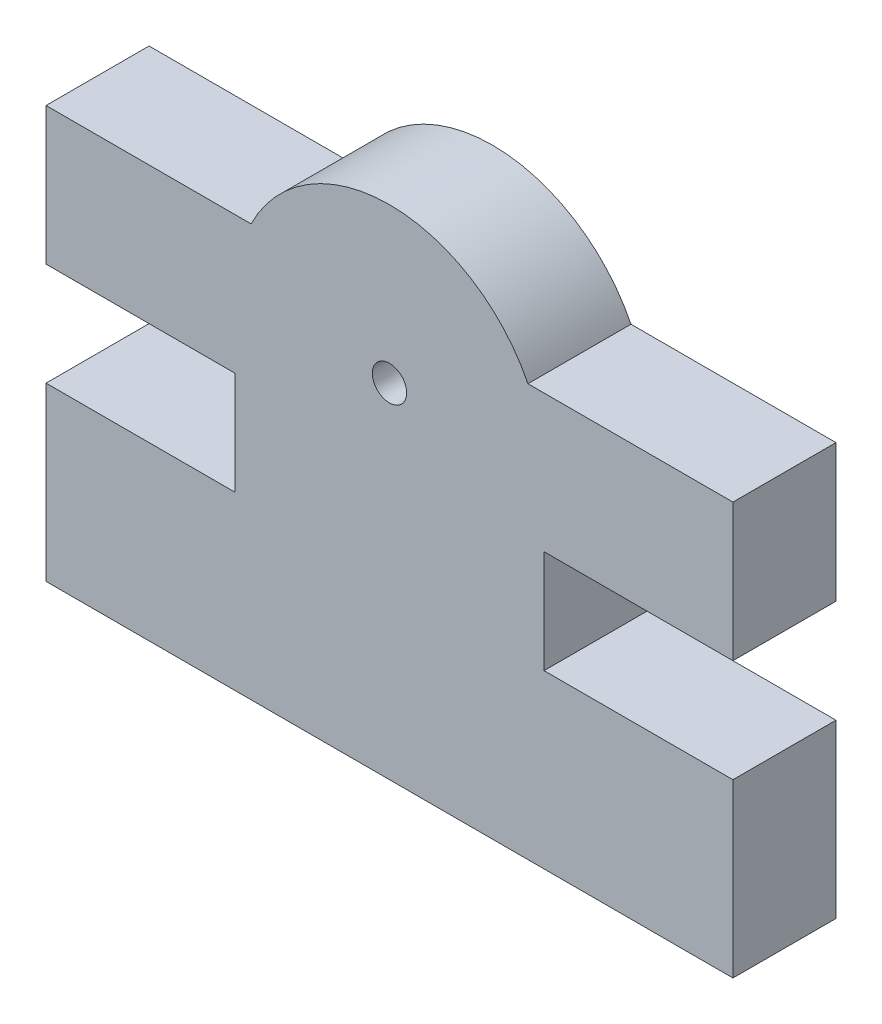
from build123d import *

# Parameters (mm, degrees)
SKETCH1_R           = 0.5
BOSS_EXTRUDE1_DEPTH = 3
SKETCH2_W           = 20
SKETCH2_H           = 3
BOSS_EXTRUDE2_DEPTH = 5


with BuildPart() as part:
    # Sketch1 → Boss-Extrude1 (new body)
    with BuildSketch(Plane.XY):
        with BuildLine():
            Line((0.468871097, 6.999999884), (-5.5, 6.999999884))
            Line((-5.5, 6.999999884), (-5.5, 3))
            Line((-5.5, 3), (0, 3))
            Line((0, 3), (0, 0))
            Line((0, 0), (9, 0))
            Line((9, 0), (9, 3))
            Line((9, 3), (14.5, 3))
            Line((14.5, 3), (14.5, 6.999999884))
            Line((14.5, 6.999999884), (8.531128903, 6.999999884))
            ThreePointArc((8.531128903, 6.999999884), (4.5, 9.499999942), (0.468871097, 6.999999884))
        make_face()
        with Locations((4.5, 4.999999942)):
            Circle(SKETCH1_R, mode=Mode.SUBTRACT)
    extrude(amount=BOSS_EXTRUDE1_DEPTH)

    # Sketch2 → Boss-Extrude2 (add)
    with BuildSketch(Plane.XZ):
        with Locations((4.5, 1.5)):
            Rectangle(SKETCH2_W, SKETCH2_H)
    extrude(amount=BOSS_EXTRUDE2_DEPTH)


solid = part.part
